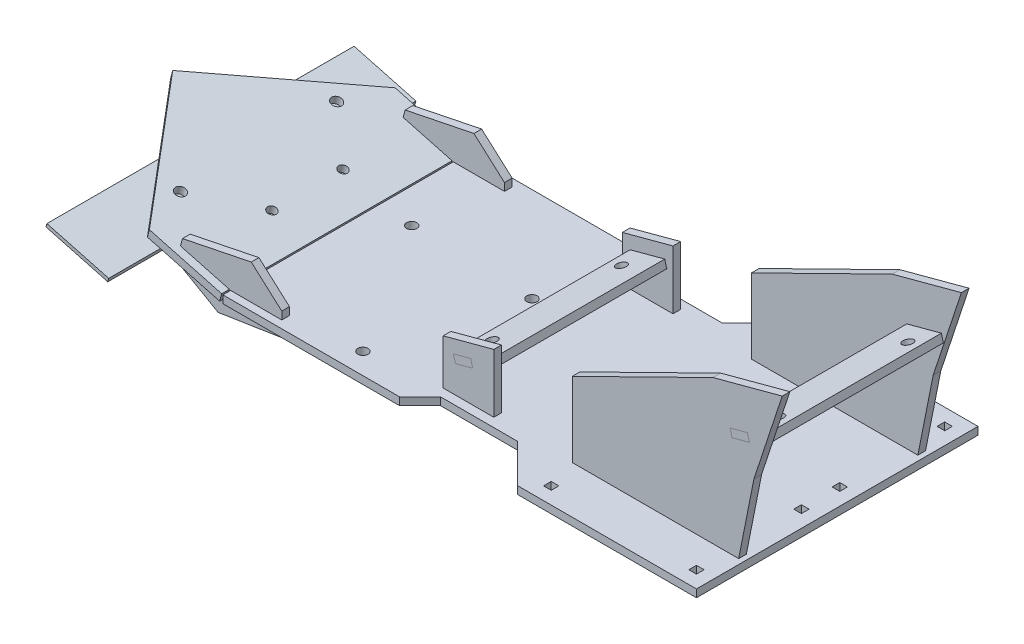
from build123d import *

# Parameters (mm, degrees)
BOSS_EXTRUDE1_DEPTH  = 3
SKETCH10_W           = 3
SKETCH10_H           = 3
CUT_EXTRUDE3_DEPTH   = 10
SKETCH11_W           = 10
SKETCH11_H           = 3
CUT_EXTRUDE4_DEPTH   = 10
BOSS_EXTRUDE5_DEPTH  = 3
SKETCH13_R           = 2
BOSS_EXTRUDE6_DEPTH  = 3
SKETCH14_R           = 2
SKETCH14_W           = 7
SKETCH14_H           = 3
BOSS_EXTRUDE7_DEPTH  = 3
SKETCH15_W           = 11.761480784
SKETCH15_H           = 3
BOSS_EXTRUDE8_DEPTH  = 3
SKETCH15_3_W         = 11.761480784
SKETCH15_3_H         = 3
CUT_EXTRUDE6_DEPTH   = 3
CUT_EXTRUDE7_DEPTH   = 3
BOSS_EXTRUDE9_DEPTH  = 3
BOSS_EXTRUDE10_DEPTH = 3
SKETCH19_R           = 2
CUT_EXTRUDE8_DEPTH   = 10
SKETCH24_R           = 1.75
CUT_EXTRUDE12_DEPTH  = 3
BOSS_EXTRUDE12_DEPTH = 3
CUT_EXTRUDE13_DEPTH  = 3
SKETCH27_R           = 2
CUT_EXTRUDE14_DEPTH  = 3
SKETCH29_W           = 25
SKETCH29_H           = 120
BOSS_EXTRUDE13_DEPTH = 1.4
SKETCH30_R           = 2
CUT_EXTRUDE15_DEPTH  = 30.4


with BuildPart() as part:
    # Sketch1 → Boss-Extrude1 (new body)
    with BuildSketch(Plane(origin=(0, 0, 0), x_dir=(1, 0, 0), z_dir=(0, 1, 0))):
        Polygon((-70, -55), (0, -55), (0, 55), (-70, 55), (-85, 40), (-210, 40), (-250, 0), (-210, -40), (-85, -40), align=None)
    extrude(amount=-BOSS_EXTRUDE1_DEPTH)

    # Sketch10 → Cut-Extrude3 (cut)
    with BuildSketch(Plane(origin=(0, 0, 0), x_dir=(1, 0, 0), z_dir=(0, 1, 0))):
        with Locations((-63.236231, -7.5)):
            Rectangle(SKETCH10_W, SKETCH10_H)
        with Locations((-63.236231, -48.5)):
            Rectangle(SKETCH10_W, SKETCH10_H)
        with Locations((-6.5, -48.5)):
            Rectangle(SKETCH10_W, SKETCH10_H)
        with Locations((-6.5, -7.5)):
            Rectangle(SKETCH10_W, SKETCH10_H)
        with Locations((-6.5, 7.5)):
            Rectangle(SKETCH10_W, SKETCH10_H)
        with Locations((-6.5, 48.5)):
            Rectangle(SKETCH10_W, SKETCH10_H)
        with Locations((-63.236231, 48.5)):
            Rectangle(SKETCH10_W, SKETCH10_H)
        with Locations((-63.236231, 7.5)):
            Rectangle(SKETCH10_W, SKETCH10_H)
    extrude(amount=-CUT_EXTRUDE3_DEPTH, mode=Mode.SUBTRACT)

    # Sketch11 → Cut-Extrude4 (cut)
    with BuildSketch(Plane(origin=(0, 0, 0), x_dir=(1, 0, 0), z_dir=(0, 1, 0))):
        with Locations((-13, -35)):
            Rectangle(SKETCH11_W, SKETCH11_H)
        with Locations((-13, 35)):
            Rectangle(SKETCH11_W, SKETCH11_H)
        with Locations((-55, 35)):
            Rectangle(SKETCH11_W, SKETCH11_H)
        with Locations((-55, -35)):
            Rectangle(SKETCH11_W, SKETCH11_H)
    extrude(amount=-CUT_EXTRUDE4_DEPTH, mode=Mode.SUBTRACT)

    # Sketch15<3> → Cut-Extrude6 (cut)
    # profile 1 of 2: a face of its own
    with BuildSketch(Plane(origin=(0, 0, -33.5), x_dir=(-1, 0, 0), z_dir=(0, 0, -1))):
        Polygon((97.670134296, 0), (117.43161508, 0), (117.43161508, 17.663270368), (97.670134296, 22.958343186), align=None)
        Polygon((112.655157945, 10.660908757), (113.43161508, 13.558686236), (106.670134296, 15.370419552), (100.874579339, 16.923333822), (100.098122203, 14.025556343), (105.893677161, 12.472642073), align=None, mode=Mode.SUBTRACT)
    # profile 2 of 2: a face of its own
    with BuildSketch(Plane(origin=(0, 0, -33.5), x_dir=(-1, 0, 0), z_dir=(0, 0, -1))):
        with Locations((107.550874688, -1.5)):
            Rectangle(SKETCH15_3_W, SKETCH15_3_H)
    cut_extrude6 = extrude(amount=CUT_EXTRUDE6_DEPTH, mode=Mode.SUBTRACT)

    # Mirror5: Cut-Extrude6 across plane
    add(cut_extrude6.mirror(Plane.XY), mode=Mode.SUBTRACT)

    # Sketch17 → Cut-Extrude7 (cut)
    with BuildSketch(Plane(origin=(0, 0, 0), x_dir=(1, 0, 0), z_dir=(0, 1, 0))):
        Polygon((-192, -40), (-192, 40), (-210, 40), (-250, 0), (-210, -40), align=None)
    extrude(amount=-CUT_EXTRUDE7_DEPTH, mode=Mode.SUBTRACT)

    # Sketch20 → Boss-Extrude10 (add)
    with BuildSketch(Plane(origin=(0, 0, 0), x_dir=(1, 0, 0), z_dir=(0, 1, 0))):
        Polygon((-115, -40), (-192, -40), (-192, -48), (-123, -48), align=None)
        Polygon((-192, 48), (-192, 40), (-115, 40), (-123, 48), align=None)
    extrude(amount=-BOSS_EXTRUDE10_DEPTH)

    # Sketch19 → Cut-Extrude8 (cut)
    with BuildSketch(Plane(origin=(0, 0, 0), x_dir=(1, 0, 0), z_dir=(0, 1, 0))):
        with Locations(Location((-130.301621673, 11.049999775, 0), (0, 0, 270))):
            Circle(SKETCH19_R)
        with Locations(Location((-178.561621814, 12.319994418, 0), (0, 0, 270))):
            Circle(SKETCH19_R)
        with Locations(Location((-145.541616034, -39.750001917, 0), (0, 0, 270))):
            Circle(SKETCH19_R)
    extrude(amount=-CUT_EXTRUDE8_DEPTH, mode=Mode.SUBTRACT)


with BuildPart() as body_2:
    # Sketch12 → Boss-Extrude5 (new body)
    with BuildSketch(Plane.XY.offset(-36.5)):
        Polygon((-8, -3), (-8, 0), (-2, 0), (3.967923412, 30), (15.016198358, 63.505316822), (-12, 56.26634829), (-67, 29.176380902), (-67, 0), (-60, 0), (-60, -3), (-50, -3), (-50, 0), (-18, 0), (-18, -3), align=None)
        Polygon((-4.577717242, 39.620171714), (-5.354174377, 42.517949192), (1.407306407, 44.329682508), (2.183763542, 41.431905029), align=None, mode=Mode.SUBTRACT)
    extrude(amount=BOSS_EXTRUDE5_DEPTH)


with BuildPart() as body_3:
    # Mirror3: mirrored copy
    add(body_2.part.mirror(Plane.XY))


with BuildPart() as body_4:
    # Sketch13 → Boss-Extrude6 (new body)
    with BuildSketch(Plane(origin=(-10.211691838, 38.11055277, 0), x_dir=(0.9659258262890699, 0.25881904510251513, 0), z_dir=(-0.25881904510251513, 0.9659258262890699, 0))):
        Polygon((12.8327197, 33.5), (12.8327197, 36.5), (5.8327197, 36.5), (5.8327197, 33.5), (4.8327197, 33.5), (4.8327197, -33.5), (5.8327197, -33.5), (5.8327197, -36.5), (12.8327197, -36.5), (12.8327197, -33.5), (18.8327197, -33.5), (18.8327197, 33.5), align=None)
        with Locations((13.8327197, -25.24)):
            Circle(SKETCH13_R, mode=Mode.SUBTRACT)
        with Locations((13.8327197, 25.24)):
            Circle(SKETCH13_R, mode=Mode.SUBTRACT)
    extrude(amount=BOSS_EXTRUDE6_DEPTH)


with BuildPart() as body_5:
    # Sketch14 → Boss-Extrude7 (new body)
    # profile 1 of 4: a face of its own
    with BuildSketch(Plane(origin=(-10.988148973, 41.008330249, 0), x_dir=(0.9659258262890699, 0.2588190451025152, 0), z_dir=(-0.2588190451025152, 0.9659258262890699, 0))):
        Polygon((-106.0572803, 33.5), (-107.0572803, 33.5), (-107.0572803, 0), (-93.0572803, 0), (-93.0572803, 33.5), (-99.0572803, 33.5), align=None)
        with Locations(Location((-102.0572803, 25.24, 0), (0, 0, 180))):
            Circle(SKETCH14_R, mode=Mode.SUBTRACT)
    # profile 2 of 4: a face of its own
    with BuildSketch(Plane(origin=(-10.988148973, 41.008330249, 0), x_dir=(0.9659258262890699, 0.2588190451025152, 0), z_dir=(-0.2588190451025152, 0.9659258262890699, 0))):
        with Locations((-102.5572803, 35)):
            Rectangle(SKETCH14_W, SKETCH14_H)
    # profile 3 of 4: a face of its own
    with BuildSketch(Plane(origin=(-10.988148973, 41.008330249, 0), x_dir=(0.9659258262890699, 0.2588190451025152, 0), z_dir=(-0.2588190451025152, 0.9659258262890699, 0))):
        Polygon((-93.0572803, 0), (-107.0572803, 0), (-107.0572803, -33.5), (-106.0572803, -33.5), (-99.0572803, -33.5), (-93.0572803, -33.5), align=None)
        with Locations(Location((-102.0572803, -25.24, 0), (0, 0, 180))):
            Circle(SKETCH14_R, mode=Mode.SUBTRACT)
    # profile 4 of 4: a face of its own
    with BuildSketch(Plane(origin=(-10.988148973, 41.008330249, 0), x_dir=(0.9659258262890699, 0.2588190451025152, 0), z_dir=(-0.2588190451025152, 0.9659258262890699, 0))):
        with Locations((-102.5572803, -35)):
            Rectangle(SKETCH14_W, SKETCH14_H)
    extrude(amount=-BOSS_EXTRUDE7_DEPTH)


with BuildPart() as body_6:
    # Sketch15 → Boss-Extrude8 (new body)
    # profile 1 of 3: a face of its own
    with BuildSketch(Plane(origin=(0, 0, -33.5), x_dir=(-1, 0, 0), z_dir=(0, 0, -1))):
        Polygon((97.670134296, 0), (117.43161508, 0), (117.43161508, 17.663270368), (97.670134296, 22.958343186), align=None)
        Polygon((112.655157945, 10.660908757), (113.43161508, 13.558686236), (106.670134296, 15.370419552), (100.874579339, 16.923333822), (100.098122203, 14.025556343), (105.893677161, 12.472642073), align=None, mode=Mode.SUBTRACT)
    # profile 2 of 3: a face of its own
    with BuildSketch(Plane(origin=(0, 0, -33.5), x_dir=(-1, 0, 0), z_dir=(0, 0, -1))):
        with Locations((107.550874688, -1.5)):
            Rectangle(SKETCH15_W, SKETCH15_H)
    # profile 3 of 3: a face of its own
    with BuildSketch(Plane(origin=(0, 0, -33.5), x_dir=(-1, 0, 0), z_dir=(0, 0, -1))):
        Polygon((105.893677161, 12.472642073), (106.670134296, 15.370419552), (100.874579339, 16.923333822), (100.098122203, 14.025556343), align=None)
    extrude(amount=BOSS_EXTRUDE8_DEPTH)


with BuildPart() as body_7:
    # Mirror4: mirrored copy
    add(body_6.part.mirror(Plane.XY))


with BuildPart() as body_8:
    # Sketch18 → Boss-Extrude9 (new body)
    with BuildSketch(Plane(origin=(-12.861561237, -48, 0), x_dir=(0, 0, 1), z_dir=(-0.25881904510252135, -0.9659258262890681, 0))):
        Polygon((48, 185.957758648), (-48, 185.957758648), (-48, 215.180976351), (0, 255.457758648), (48, 215.180976351), align=None)
    extrude(amount=BOSS_EXTRUDE9_DEPTH)

    # Sketch24 → Cut-Extrude12 (cut)
    with BuildSketch(Plane(origin=(-12.861561237, -48, 0), x_dir=(0.9659258262890682, -0.25881904510252135, 0), z_dir=(0.2588190451025213, 0.9659258262890681, 0))):
        with Locations(Location((-200.957758648, -13.875, 0), (0, 0, 180))):
            Circle(SKETCH24_R)
        with Locations(Location((-200.957758648, 13.875, 0), (0, 0, 180))):
            Circle(SKETCH24_R)
    extrude(amount=-CUT_EXTRUDE12_DEPTH, mode=Mode.SUBTRACT)


with BuildPart() as body_9:
    # Sketch26 → Boss-Extrude12 (new body)
    with BuildSketch(Plane.XY.offset(45)):
        Polygon((-172, 3), (-183.927615219, 13.636723728), (-191.439047106, 0), (-185, 0), (-172, 0), align=None)
        Polygon((-210.806452543, 8.145002313), (-211.582909679, 5.247224834), (-199.244443697, 1.941142838), (-192.482962913, 0.129409523), (-193.259420048, -2.768367956), (-200.020900832, -0.956634641), (-212.359366814, 2.349447355), (-213.135823949, -0.548330124), (-196.881901916, -9.881299392), (-192, -1.018389004), (-192, 0), (-191.439047106, 0), (-183.927615219, 13.636723728), align=None)
        Polygon((-192, -1.018389004), (-196.881901916, -9.881299392), (-172, -6), (-172, -3), (-185, -3), (-192, -3), align=None)
        Polygon((-185, 0), (-191.439047106, 0), (-192, -1.018389004), (-192, -3), (-185, -3), align=None)
        Polygon((-192.482962913, 0.129409523), (-199.244443697, 1.941142838), (-200.020900832, -0.956634641), (-193.259420048, -2.768367956), align=None)
        Polygon((-192, -1.018389004), (-191.439047106, 0), (-192, 0), align=None)
    extrude(amount=-BOSS_EXTRUDE12_DEPTH)


with BuildPart() as cut_extrude13_tool:
    # Sketch26<3> → Cut-Extrude13 (new body)
    with BuildSketch(Plane.XY.offset(45)):
        Polygon((-192.482962913, 0.129409523), (-199.244443697, 1.941142838), (-200.020900832, -0.956634641), (-193.259420048, -2.768367956), align=None)
        Polygon((-185, 0), (-191.439047106, 0), (-192, -1.018389004), (-192, -3), (-185, -3), align=None)
        Polygon((-192, -1.018389004), (-191.439047106, 0), (-192, 0), align=None)
    cut_extrude13 = extrude(amount=-CUT_EXTRUDE13_DEPTH)


with BuildPart() as body_8_1:
    add(body_8.part)

    # Cut-Extrude13: cut by cut_extrude13_tool
    add(cut_extrude13_tool.part, mode=Mode.SUBTRACT)


with BuildPart() as part_1:
    add(part.part)

    # Cut-Extrude13: cut by cut_extrude13_tool
    add(cut_extrude13_tool.part, mode=Mode.SUBTRACT)


with BuildPart() as body_10:
    # Mirror7: mirrored copy
    add(body_9.part.mirror(Plane.XY))


with BuildPart() as mirror8_tool:
    # Mirror8: Cut-Extrude13 across plane
    add(cut_extrude13.mirror(Plane.XY))


with BuildPart() as body_8_2:
    add(body_8_1.part)

    # Mirror8: cut by mirror8_tool
    add(mirror8_tool.part, mode=Mode.SUBTRACT)

    # Sketch27 → Cut-Extrude14 (cut)
    with BuildSketch(Plane(origin=(-12.861561237, -48, 0), x_dir=(0.9659258262890681, -0.25881904510252146, 0), z_dir=(0.25881904510252146, 0.9659258262890681, 0))):
        with Locations(Location((-220.731478581, 30.495102239, 0), (0, 0, 180))):
            Circle(SKETCH27_R)
        with Locations(Location((-220.731478581, -30.495102239, 0), (0, 0, 180))):
            Circle(SKETCH27_R)
    extrude(amount=-CUT_EXTRUDE14_DEPTH, mode=Mode.SUBTRACT)


with BuildPart() as part_2:
    add(part_1.part)

    # Mirror8: cut by mirror8_tool
    add(mirror8_tool.part, mode=Mode.SUBTRACT)


with BuildPart() as body_11:
    # Sketch29 → Boss-Extrude13 (new body)
    with BuildSketch(Plane(origin=(-16.226208823, -60.557035742, 0), x_dir=(-0.9659258262890681, 0.25881904510252146, 0), z_dir=(-0.25881904510252146, -0.9659258262890681, 0))):
        with Locations((228.231478581, 0)):
            Rectangle(SKETCH29_W, SKETCH29_H)
    extrude(amount=BOSS_EXTRUDE13_DEPTH)

    # Sketch30 → Cut-Extrude15 (cut)
    with BuildSketch(Plane(origin=(-16.226208823, -60.557035742, 0), x_dir=(0.9659258262890681, -0.2588190451025215, 0), z_dir=(0.2588190451025215, 0.9659258262890681, 0))):
        with Locations(Location((-220.731478581, 30.495102239, 0), (0, 0, 180))):
            Circle(SKETCH30_R)
        with Locations(Location((-220.731478581, -30.495102239, 0), (0, 0, 180))):
            Circle(SKETCH30_R)
    extrude(amount=-CUT_EXTRUDE15_DEPTH, mode=Mode.SUBTRACT)


solid = Compound([body_2.part, body_3.part, body_4.part, body_5.part, body_6.part, body_7.part, body_9.part, body_10.part, body_8_2.part, part_2.part, body_11.part])
